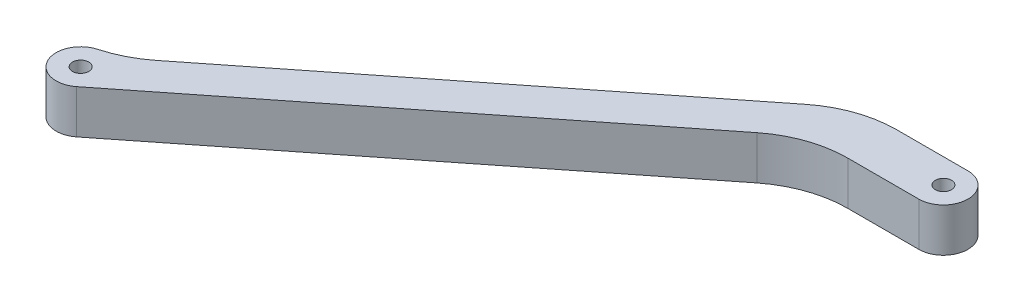
from build123d import *

# Parameters (mm, degrees)
SKETCH1_R           = 0.75
BOSS_EXTRUDE1_DEPTH = 4
FILLET1_R           = 10


with BuildPart() as part:
    # Sketch1 → Boss-Extrude1 (new body)
    with BuildSketch(Plane(origin=(0, 0, 0), x_dir=(1, 0, 0), z_dir=(0, 1, 0))):
        with BuildLine():
            Line((49, 32.45), (39, 32.45))
            Line((39, 32.45), (0.6574204, 2.151812821))
            ThreePointArc((0.6574204, 2.151812821), (-2.211145355, -0.416336667), (1.394986025, -1.765365115))
            Line((1.394986025, -1.765365115), (39, 27.95))
            Line((39, 27.95), (49, 27.95))
            ThreePointArc((49, 27.95), (51.25, 30.2), (49, 32.45))
        make_face()
        with Locations(Location((49, 30.2, 0), (0, 0, 270))):
            Circle(SKETCH1_R, mode=Mode.SUBTRACT)
        with Locations(Location((0, 0, 0), (0, 0, 270))):
            Circle(SKETCH1_R, mode=Mode.SUBTRACT)
    extrude(amount=-BOSS_EXTRUDE1_DEPTH)

    # Fillet1
    fillet1_edges = [part.edges().sort_by_distance(p)[0] for p in [
        (39, -2, -27.95),
        (0.6574204, -2, -2.151812821),
        (39, -2, -32.45),
    ]]
    fillet(fillet1_edges, radius=FILLET1_R)


solid = part.part
